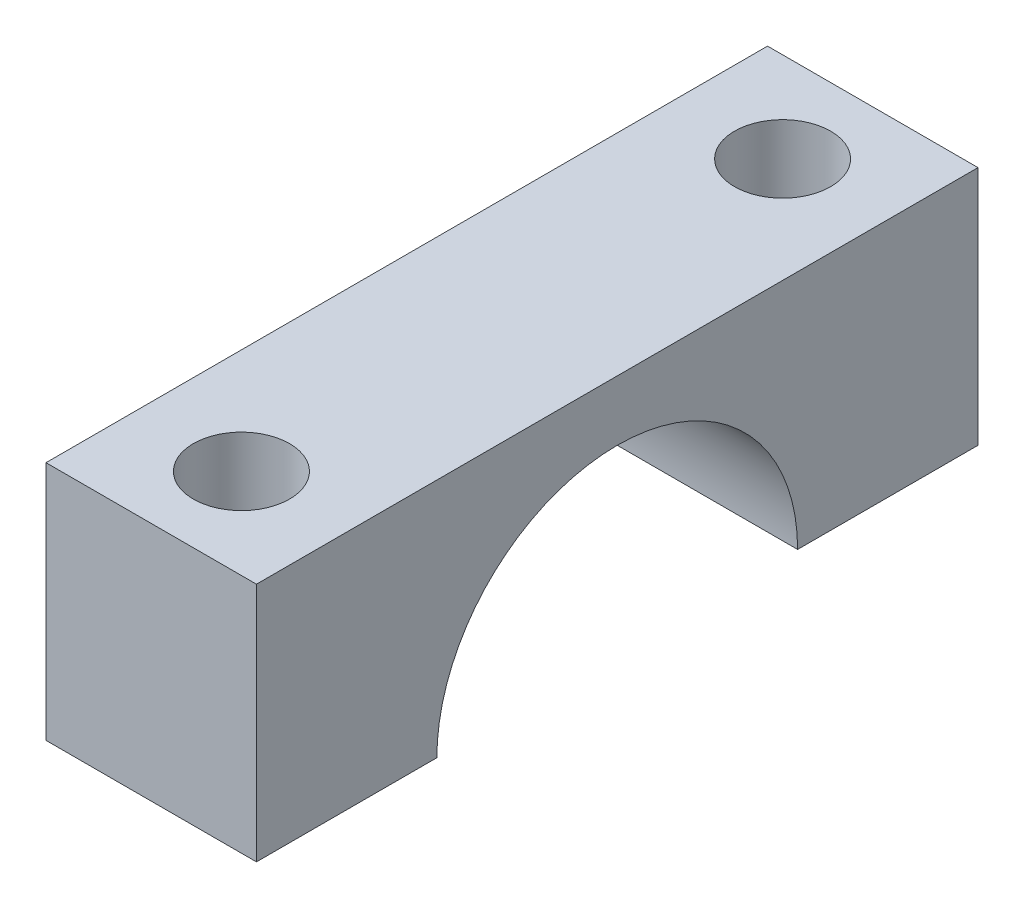
from build123d import *

# Parameters (mm, degrees)
SKETCH_1_W          = 7
SKETCH_1_H          = 24
EXTRUDE_1_DEPTH     = 8
SKETCH_2_R          = 6
CUT_EXTRUDE_1_DEPTH = 7
SKETCH_3_R          = 1.6
CUT_EXTRUDE_2_DEPTH = 27.248809497


with BuildPart() as part:
    # 草图1 → 凸台-拉伸1 (new body)
    with BuildSketch(Plane(origin=(0, 0, 0), x_dir=(1, 0, 0), z_dir=(0, 1, 0))):
        with Locations((3.5, -12)):
            Rectangle(SKETCH_1_W, SKETCH_1_H)
    extrude(amount=EXTRUDE_1_DEPTH)

    # 草图2 → 切除-拉伸1 (cut)
    with BuildSketch(Plane.ZY):
        with Locations((12, 0)):
            Circle(SKETCH_2_R)
    extrude(amount=-CUT_EXTRUDE_1_DEPTH, mode=Mode.SUBTRACT)

    # 草图3 → 切除-拉伸2 (cut, through all)
    with BuildSketch(Plane.XZ):
        with Locations(Location((3.5, 21, 0), (0, 0, 270))):
            Circle(SKETCH_3_R)
        with Locations(Location((3.5, 3, 0), (0, 0, 270))):
            Circle(SKETCH_3_R)
    extrude(amount=-CUT_EXTRUDE_2_DEPTH, mode=Mode.SUBTRACT)


solid = part.part
